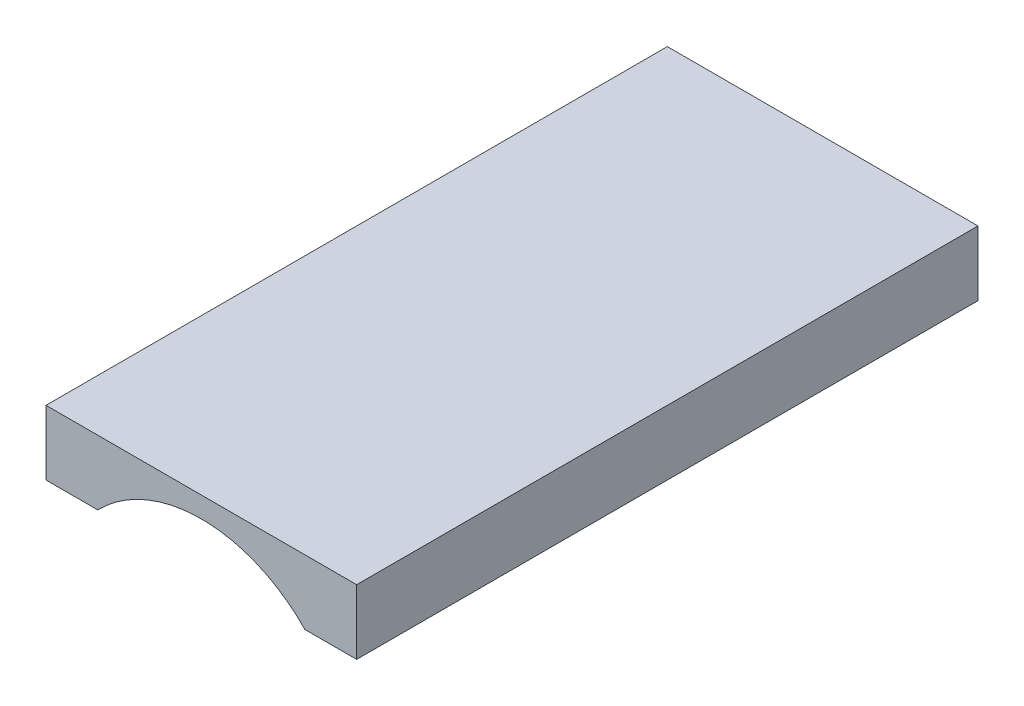
from build123d import *

# Parameters (mm, degrees)
SKETCH1_W               = 60
SKETCH1_H               = 6.25
BOSS_EXTRUDE1_DEPTH     = 30
CUT_EXTRUDE1_DEPTH      = 68.372564891
CUT_EXTRUDE1_DEPTH_BACK = 45
CUT_EXTRUDE2_DEPTH      = 13


with BuildPart() as part:
    # Sketch1 → Boss-Extrude1 (new body)
    with BuildSketch(Plane(origin=(0, 0, 0), x_dir=(0, 0, -1), z_dir=(1, 0, 0))):
        with Locations((30, 3.125)):
            Rectangle(SKETCH1_W, SKETCH1_H)
    extrude(amount=BOSS_EXTRUDE1_DEPTH)

    # Sketch2 → Cut-Extrude1 (cut, two sides: drawn at the far end of the back side and taken through both)
    with BuildSketch(Plane.XY.offset(-CUT_EXTRUDE1_DEPTH_BACK)):
        with BuildLine():
            Line((5, 0), (25, 0))
            ThreePointArc((25, 0), (15, 4.25), (5, 0))
        make_face()
    extrude(amount=CUT_EXTRUDE1_DEPTH + CUT_EXTRUDE1_DEPTH_BACK, mode=Mode.SUBTRACT)

    # Sketch3 → Cut-Extrude2 (cut)
    with BuildSketch(Plane(origin=(0, 0, -60), x_dir=(-1, 0, 0), z_dir=(0, 0, -1))):
        Polygon((-10, 2), (-10, 5), (-20, 5), (-18.5, 3.5), (-20, 2), align=None)
    extrude(amount=-CUT_EXTRUDE2_DEPTH, mode=Mode.SUBTRACT)


solid = part.part
